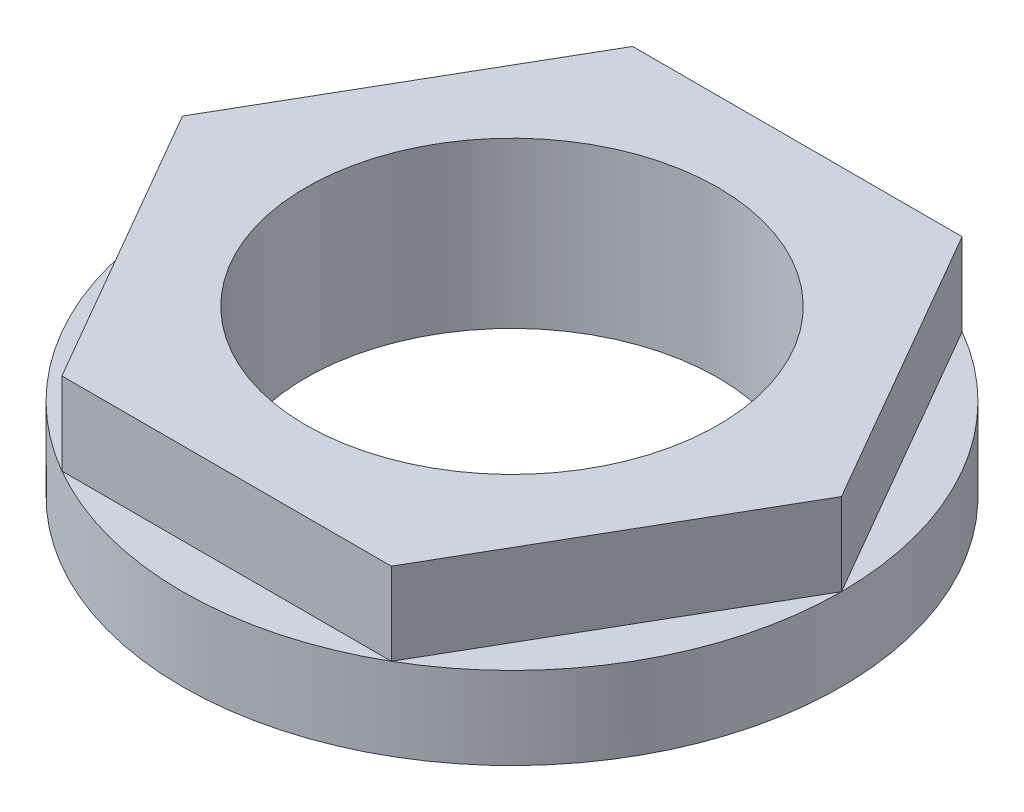
from build123d import *

# Parameters (mm, degrees)
SKETCH1_R           = 12
SKETCH1_R_2         = 7.5
BOSS_EXTRUDE1_DEPTH = 3
SKETCH2_R           = 7.5
BOSS_EXTRUDE2_DEPTH = 3


with BuildPart() as part:
    # Sketch1 → Boss-Extrude1 (new body)
    with BuildSketch(Plane(origin=(0, 0, 0), x_dir=(1, 0, 0), z_dir=(0, 1, 0))):
        with Locations(Location((0, 0, 0), (0, 0, 270))):
            Circle(SKETCH1_R)
        with Locations(Location((0, 0, 0), (0, 0, 270))):
            Circle(SKETCH1_R_2, mode=Mode.SUBTRACT)
    extrude(amount=BOSS_EXTRUDE1_DEPTH)

    # Sketch2 → Boss-Extrude2 (add)
    with BuildSketch(Plane(origin=(0, 3, 0), x_dir=(1, 0, 0), z_dir=(0, 1, 0))):
        Polygon((12, 0), (6, 10.392304845), (-6, 10.392304845), (-12, 0), (-6, -10.392304845), (6, -10.392304845), align=None)
        with Locations(Location((0, 0, 0), (0, 0, 270))):
            Circle(SKETCH2_R, mode=Mode.SUBTRACT)
    extrude(amount=BOSS_EXTRUDE2_DEPTH)


solid = part.part
